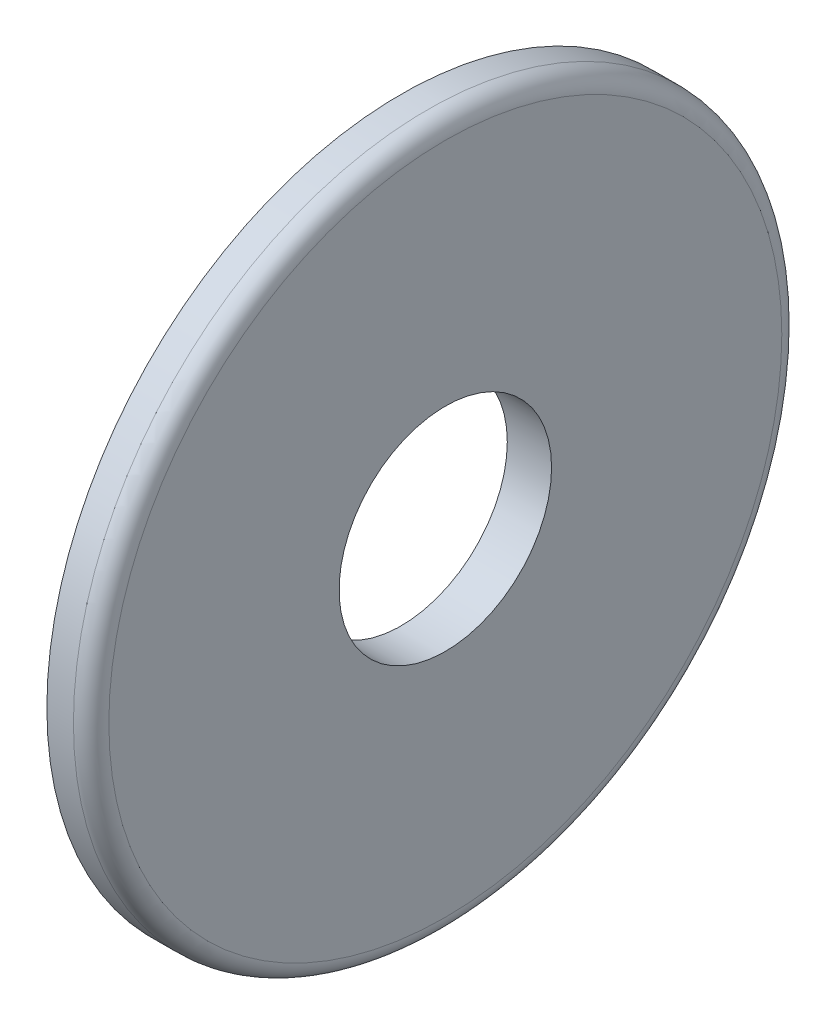
from build123d import *

# Parameters (mm, degrees)
SKETCH1_R           = 12.7
SKETCH1_R_2         = 3.81
BOSS_EXTRUDE1_DEPTH = 1.5875
FILLET1_R           = 0.635


with BuildPart() as part:
    # Sketch1 → Boss-Extrude1 (new body)
    with BuildSketch(Plane(origin=(0, 0, 0), x_dir=(0, 0, -1), z_dir=(1, 0, 0))):
        Circle(SKETCH1_R)
        Circle(SKETCH1_R_2, mode=Mode.SUBTRACT)
    extrude(amount=BOSS_EXTRUDE1_DEPTH)

    # Fillet1
    fillet1_edges = [part.edges().sort_by_distance(p)[0] for p in [
        (1.5875, 0, 12.7),
    ]]
    fillet(fillet1_edges, radius=FILLET1_R)


solid = part.part
